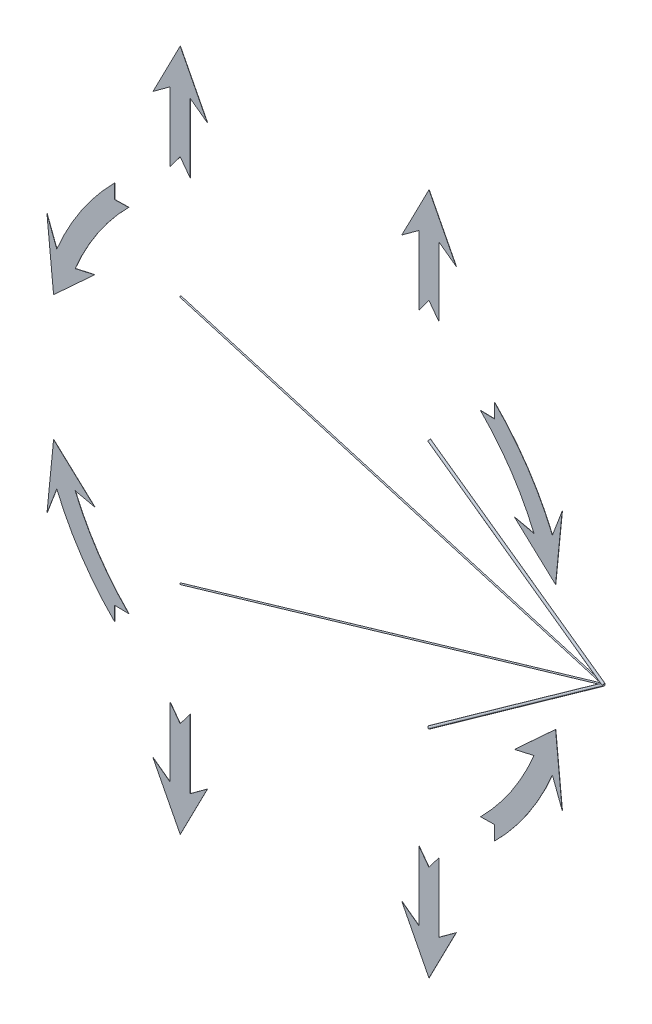
from build123d import *

# Parameters (mm, degrees)
EXTRUDE_1_DEPTH   = 0.1
SWEEP_1_PROFILE_R = 0.25
SWEEP_3_PROFILE_R = 0.5
EXTRUDE_2_DEPTH   = 0.1
EXTRUDE_2_2_DEPTH = 0.1
EXTRUDE_2_3_DEPTH = 0.1
EXTRUDE_2_4_DEPTH = 0.1


with BuildPart() as part:
    # 草图1 → 凸台-拉伸1 (new body)
    with BuildSketch(Plane.XY):
        with BuildLine():
            Line((-76.367532368, 70.597450379), (-76.367532368, 76.367532368))
            ThreePointArc((-76.367532368, 76.367532368), (-89.675372689, 60.185775172), (-99.608486096, 41.739064409))
            Line((-99.608486096, 41.739064409), (-103.547392889, 52.081418243))
            Line((-103.547392889, 52.081418243), (-100.893939345, 25.227227425))
            Line((-100.893939345, 25.227227425), (-84.393596676, 40.415809557))
            Line((-84.393596676, 40.415809557), (-92.227129015, 38.654322834))
            ThreePointArc((-92.227129015, 38.654322834), (-83.030625235, 55.730739033), (-70.710678119, 70.710678119))
            Line((-70.710678119, 70.710678119), (-76.367532368, 70.597450379))
        make_face()
    extrude(amount=EXTRUDE_1_DEPTH)


with BuildPart() as body_2:
    # 扫描1: sweep along a path in 草图2
    with BuildLine(Plane.XY) as sweep_1_path:
        Line((-50, 50), (120.097414724, 0))
    # 扫描1 profile (on start of the path) → 扫描1 (sweep)
    with BuildSketch(Plane(origin=(-50, 50, 0), x_dir=(0.28201758324220955, 0.9594092363231779, 0), z_dir=(0.9594092363231779, -0.28201758324220955, 0))):
        Circle(SWEEP_1_PROFILE_R)
    sweep(path=sweep_1_path.line)

    # 扫描3: sweep along a path in 草图10
    with BuildLine(Plane.XY) as sweep_3_path:
        Line((50, 50), (120.097414724, 0))
    # 扫描3 profile (on start of the path) → 扫描3 (sweep)
    with BuildSketch(Plane(origin=(50, 50, 0), x_dir=(0.5807029557109349, 0.8141155183563227, 0), z_dir=(0.8141155183563227, -0.5807029557109349, 0))):
        Circle(SWEEP_3_PROFILE_R)
    sweep(path=sweep_3_path.line)


with BuildPart() as body_3:
    # 镜向3: mirrored copy
    add(part.part.mirror(Plane.ZX))


with BuildPart() as body_4:
    # Mirror 3 2: mirrored copy
    add(body_2.part.mirror(Plane.ZX))


with BuildPart() as body_5:
    # 镜向4: mirrored copy
    add(part.part.mirror(Plane(origin=(0, 0, 0), x_dir=(0, 0, 1), z_dir=(1, 0, 0))))


with BuildPart() as body_6:
    # Mirror 4 2: mirrored copy
    add(body_3.part.mirror(Plane(origin=(0, 0, 0), x_dir=(0, 0, 1), z_dir=(1, 0, 0))))


with BuildPart() as body_7:
    # 草图27 → 凸台-拉伸2 (new body)
    with BuildSketch(Plane.XY):
        Polygon((-50, 137.198385156), (-60.926273457, 115.98084523), (-54, 121.047126497), (-54, 93.313859271), (-50, 98.688027033), (-46, 93.313859271), (-46, 121.047126497), (-39.073726543, 115.98084523), align=None)
    extrude(amount=EXTRUDE_2_DEPTH)


with BuildPart() as body_8:
    # 草图27 → Extrude 2 2 (new body)
    with BuildSketch(Plane.XY):
        Polygon((50, 137.198385156), (39.073726543, 115.98084523), (46, 121.047126497), (46, 93.313859271), (50, 98.688027033), (54, 93.313859271), (54, 121.047126497), (60.926273457, 115.98084523), align=None)
    extrude(amount=EXTRUDE_2_2_DEPTH)


with BuildPart() as body_9:
    # 草图27 → Extrude 2 3 (new body)
    with BuildSketch(Plane.XY):
        Polygon((50, -137.198385156), (60.926273457, -115.98084523), (54, -121.047126497), (54, -93.313859271), (50, -98.688027033), (46, -93.313859271), (46, -121.047126497), (39.073726543, -115.98084523), align=None)
    extrude(amount=EXTRUDE_2_3_DEPTH)


with BuildPart() as body_10:
    # 草图27 → Extrude 2 4 (new body)
    with BuildSketch(Plane.XY):
        Polygon((-50, -137.198385156), (-39.073726543, -115.98084523), (-46, -121.047126497), (-46, -93.313859271), (-50, -98.688027033), (-54, -93.313859271), (-54, -121.047126497), (-60.926273457, -115.98084523), align=None)
    extrude(amount=EXTRUDE_2_4_DEPTH)


solid = Compound([part.part, body_2.part, body_3.part, body_4.part, body_5.part, body_6.part, body_7.part, body_8.part, body_9.part, body_10.part])
